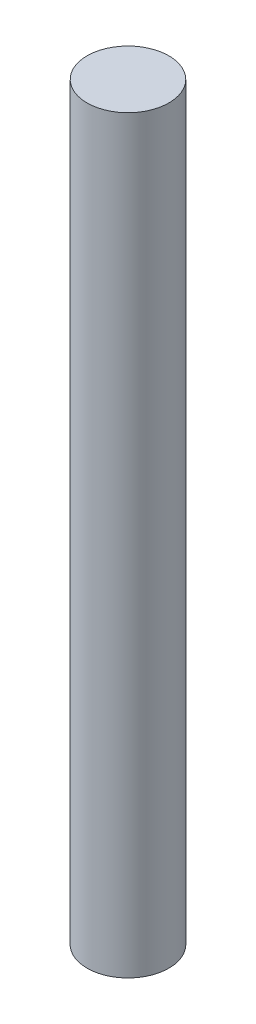
from build123d import *

# Parameters (mm, degrees)
SKETCH1_R           = 3
BOSS_EXTRUDE1_DEPTH = 55


with BuildPart() as part:
    # Sketch1 → Boss-Extrude1 (new body)
    with BuildSketch(Plane(origin=(0, 0, 0), x_dir=(1, 0, 0), z_dir=(0, 1, 0))):
        with Locations(Location((0, 0, 0), (0, 0, 270))):
            Circle(SKETCH1_R)
    extrude(amount=BOSS_EXTRUDE1_DEPTH)


solid = part.part
